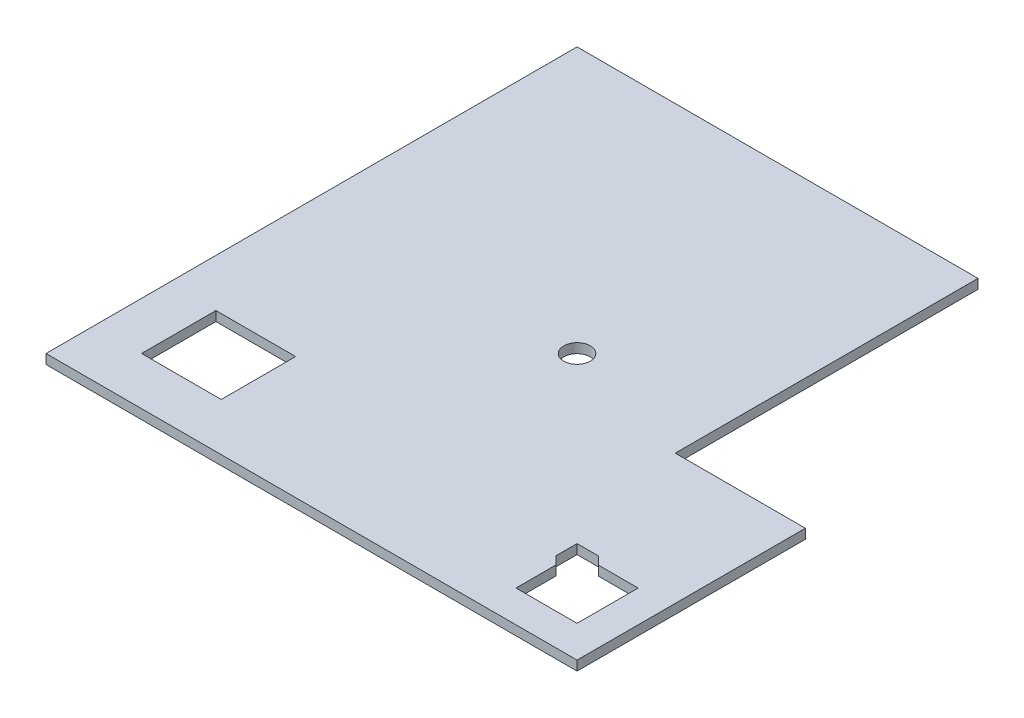
from build123d import *

# Parameters (mm, degrees)
BOSS_EXTRUDE1_DEPTH = 18
SKETCH3_W           = 150
SKETCH3_H           = 140
CUT_EXTRUDE2_DEPTH  = 18
CUT_EXTRUDE3_DEPTH  = 18
SKETCH5_R           = 25
CUT_EXTRUDE4_DEPTH  = 1415.328109033


with BuildPart() as part:
    # Sketch1 → Boss-Extrude1 (new body)
    with BuildSketch(Plane(origin=(0, 0, 0), x_dir=(1, 0, 0), z_dir=(0, 1, 0))):
        Polygon((0, 0), (1000, 0), (1000, 430), (755, 430), (755, 1000), (0, 1000), align=None)
    extrude(amount=BOSS_EXTRUDE1_DEPTH)

    # Sketch3 → Cut-Extrude2 (cut)
    with BuildSketch(Plane(origin=(0, 18, 0), x_dir=(1, 0, 0), z_dir=(0, 1, 0))):
        with Locations((165, 160)):
            Rectangle(SKETCH3_W, SKETCH3_H)
    extrude(amount=-CUT_EXTRUDE2_DEPTH, mode=Mode.SUBTRACT)

    # Sketch4 → Cut-Extrude3 (cut)
    with BuildSketch(Plane(origin=(0, 18, 0), x_dir=(1, 0, 0), z_dir=(0, 1, 0))):
        Polygon((940, 60), (940, 175), (865, 175), (850, 190), (810, 190), (810, 150), (825, 135), (825, 60), align=None)
    extrude(amount=-CUT_EXTRUDE3_DEPTH, mode=Mode.SUBTRACT)

    # Sketch5 → Cut-Extrude4 (cut, through all)
    with BuildSketch(Plane(origin=(0, 18, 0), x_dir=(1, 0, 0), z_dir=(0, 1, 0))):
        with Locations(Location((500, 500, 0), (0, 0, 270))):
            Circle(SKETCH5_R)
    extrude(amount=-CUT_EXTRUDE4_DEPTH, mode=Mode.SUBTRACT)


solid = part.part
